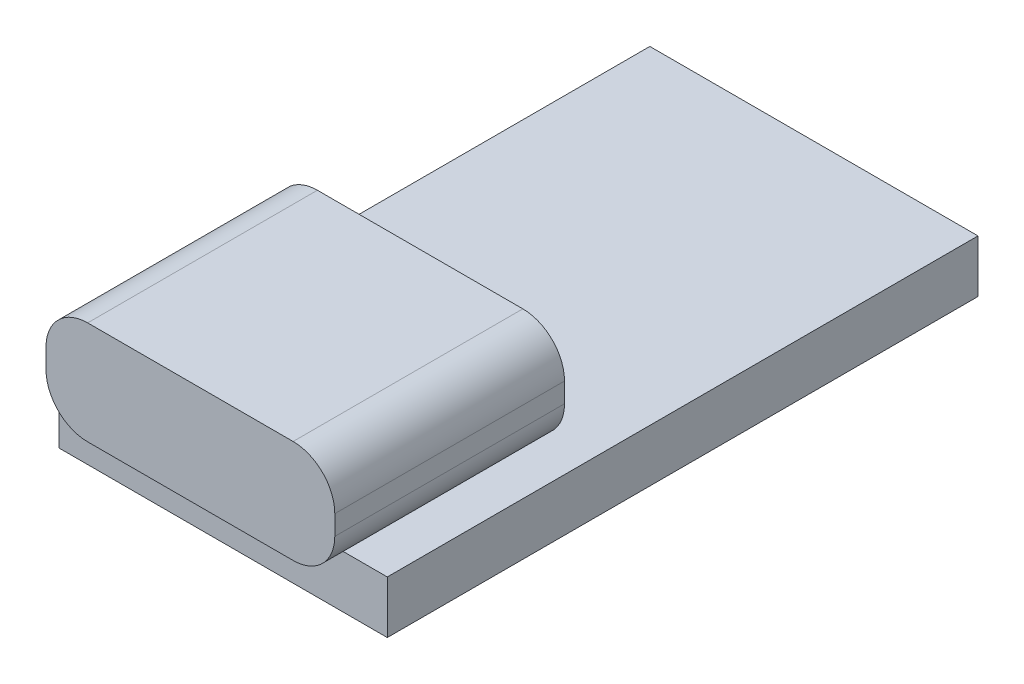
from build123d import *

# Parameters (mm, degrees)
SKETCH1_W           = 10
SKETCH1_H           = 18
BOSS_EXTRUDE1_DEPTH = 1.6
BOSS_EXTRUDE2_DEPTH = 7


with BuildPart() as part:
    # Sketch1 → Boss-Extrude1 (new body)
    with BuildSketch(Plane(origin=(0, 0, 0), x_dir=(1, 0, 0), z_dir=(0, 1, 0))):
        with Locations((5, 9)):
            Rectangle(SKETCH1_W, SKETCH1_H)
    extrude(amount=BOSS_EXTRUDE1_DEPTH)

    # Sketch3 → Boss-Extrude2 (add)
    with BuildSketch(Plane.XY.offset(1)):
        with BuildLine():
            Line((1.87, 4.74), (8.13, 4.74))
            ThreePointArc((8.13, 4.74), (9.028025612, 4.368025612), (9.4, 3.47))
            Line((9.4, 3.47), (9.4, 2.87))
            ThreePointArc((9.4, 2.87), (9.028025612, 1.971974388), (8.13, 1.6))
            Line((8.13, 1.6), (1.87, 1.6))
            ThreePointArc((1.87, 1.6), (0.971974388, 1.971974388), (0.6, 2.87))
            Line((0.6, 2.87), (0.6, 3.47))
            ThreePointArc((0.6, 3.47), (0.971974388, 4.368025612), (1.87, 4.74))
        make_face()
    extrude(amount=-BOSS_EXTRUDE2_DEPTH)


solid = part.part
